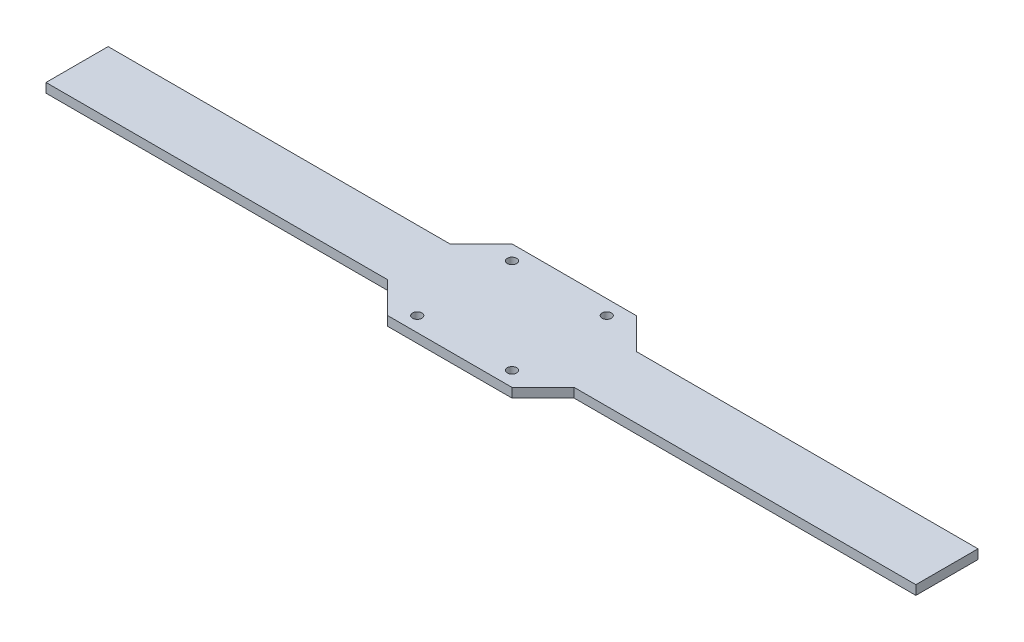
from build123d import *

# Parameters (mm, degrees)
SKETCH1_R           = 1.5
BOSS_EXTRUDE1_DEPTH = 1.5


with BuildPart() as part:
    # Sketch1 → Boss-Extrude1 (new, symmetric)
    with BuildSketch(Plane(origin=(0, 0, 0), x_dir=(1, 0, 0), z_dir=(0, 1, 0))):
        Polygon((30, 10), (20, 20), (-20, 20), (-30, 10), (-140, 10), (-140, -10), (-30, -10), (-20, -20), (20, -20), (30, -10), (140, -10), (140, 10), align=None)
        with Locations(Location((-15.25, -15.25, 0), (0, 0, 270))):
            Circle(SKETCH1_R, mode=Mode.SUBTRACT)
        with Locations(Location((15.25, -15.25, 0), (0, 0, 270))):
            Circle(SKETCH1_R, mode=Mode.SUBTRACT)
        with Locations(Location((-15.25, 15.25, 0), (0, 0, 270))):
            Circle(SKETCH1_R, mode=Mode.SUBTRACT)
        with Locations(Location((15.25, 15.25, 0), (0, 0, 270))):
            Circle(SKETCH1_R, mode=Mode.SUBTRACT)
    extrude(amount=BOSS_EXTRUDE1_DEPTH, both=True)


solid = part.part
